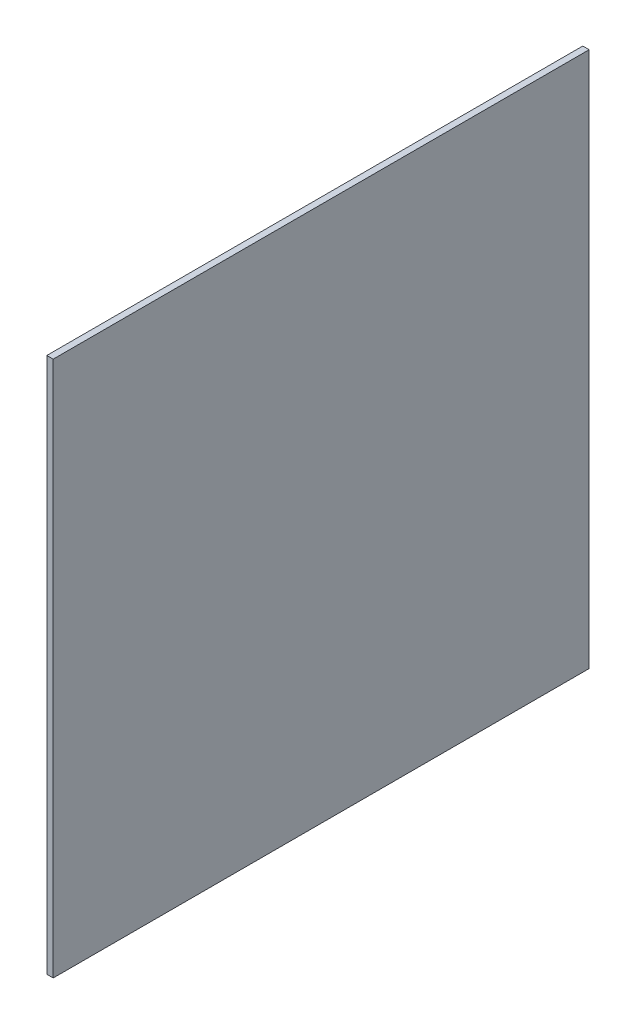
from build123d import *

# Parameters (mm, degrees)
SKETCH1_W           = 133.35
SKETCH1_H           = 133.35
BOSS_EXTRUDE1_DEPTH = 1.5875


with BuildPart() as part:
    # Sketch1 → Boss-Extrude1 (new body)
    with BuildSketch(Plane(origin=(0, 0, 0), x_dir=(0, 0, -1), z_dir=(1, 0, 0))):
        with Locations((66.675, 66.675)):
            Rectangle(SKETCH1_W, SKETCH1_H)
    extrude(amount=BOSS_EXTRUDE1_DEPTH)


solid = part.part
